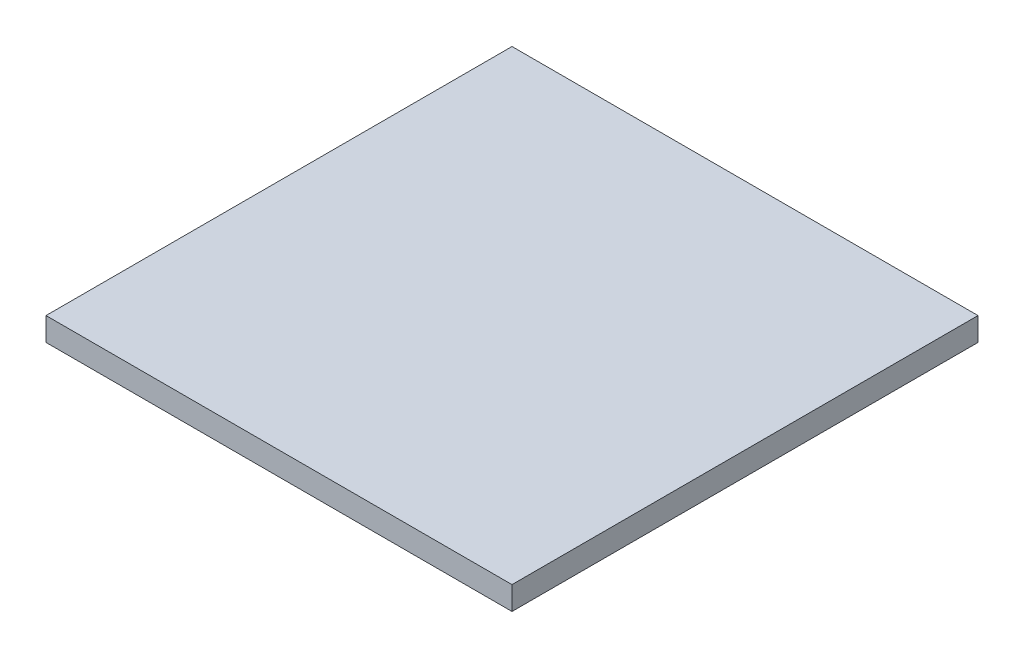
from build123d import *

# Parameters (mm, degrees)
SKETCH2_W           = 20000
SKETCH2_H           = 20000
BOSS_EXTRUDE1_DEPTH = 1000


with BuildPart() as part:
    # Sketch2 → Boss-Extrude1 (new body)
    with BuildSketch(Plane(origin=(0, 0, 0), x_dir=(1, 0, 0), z_dir=(0, 1, 0))):
        Rectangle(SKETCH2_W, SKETCH2_H)
    extrude(amount=-BOSS_EXTRUDE1_DEPTH)


solid = part.part
